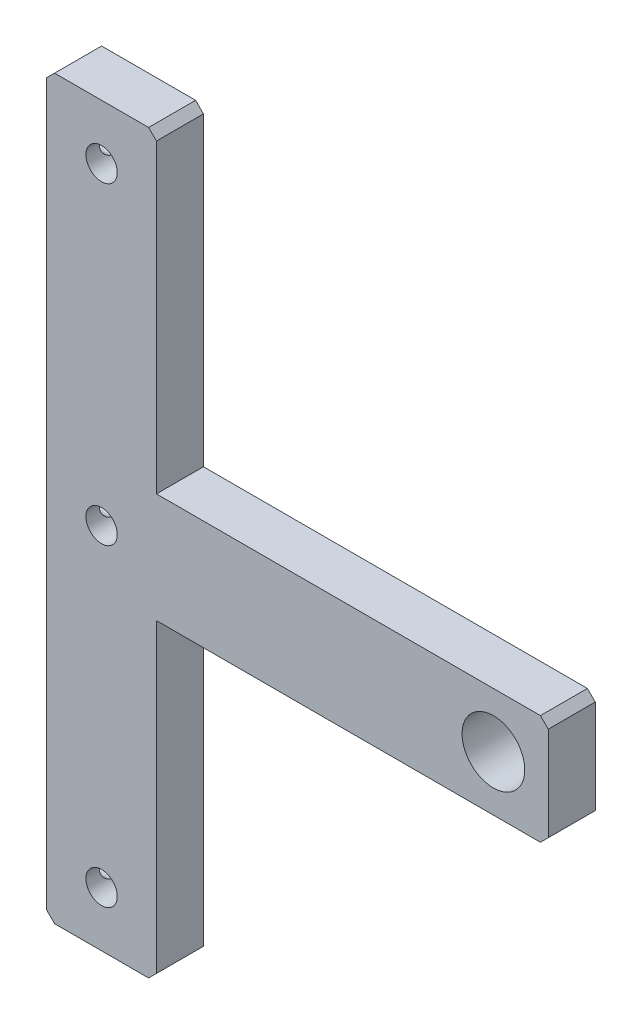
from build123d import *

# Parameters (mm, degrees)
EXTRUDE_1_DEPTH     = 6
SKETCH_4_R          = 2
SKETCH_4_R_2        = 4
CUT_EXTRUDE_2_DEPTH = 80.630396206
M3X0_5_1_REACH      = 81.63
M3X0_5_1_BORE_R     = 1.25
CHAMFER_1_SIZE      = 1


with BuildPart() as part:
    # ｽｹｯﾁ3 → ﾎﾞｽ - 押し出し1 (new body)
    with BuildSketch(Plane.XY):
        Polygon((0, -47), (0, 47), (14, 47), (14, 7), (64, 7), (64, -7), (14, -7), (14, -47), align=None)
    extrude(amount=EXTRUDE_1_DEPTH)

    # ｽｹｯﾁ4 → ｶｯﾄ - 押し出し2 (cut, through all)
    with BuildSketch(Plane.XY.offset(6)):
        with Locations((7, 40)):
            Circle(SKETCH_4_R)
        with Locations((7, -40)):
            Circle(SKETCH_4_R)
        with Locations((7, 0)):
            Circle(SKETCH_4_R)
        with Locations((57, 0)):
            Circle(SKETCH_4_R_2)
    extrude(amount=-CUT_EXTRUDE_2_DEPTH, mode=Mode.SUBTRACT)

    # M3x0.5 ねじ穴1 bore → M3x0.5 ねじ穴1 (cut, up to next)
    with BuildSketch(Plane.ZY, mode=Mode.PRIVATE) as m3x0_5_1_sk1:
        with Locations((3, -40)):
            Circle(M3X0_5_1_BORE_R)
    m3x0_5_1_tool1 = extrude(m3x0_5_1_sk1.sketch, amount=-M3X0_5_1_REACH, mode=Mode.PRIVATE) & part.part
    # M3x0.5 ねじ穴1 bore → M3x0.5 ねじ穴1 (cut, up to next)
    with BuildSketch(Plane.ZY, mode=Mode.PRIVATE) as m3x0_5_1_sk2:
        with Locations((3, 40)):
            Circle(M3X0_5_1_BORE_R)
    m3x0_5_1_tool2 = extrude(m3x0_5_1_sk2.sketch, amount=-M3X0_5_1_REACH, mode=Mode.PRIVATE) & part.part
    # M3x0.5 ねじ穴1 bore → M3x0.5 ねじ穴1 (cut, up to next)
    with BuildSketch(Plane.ZY, mode=Mode.PRIVATE) as m3x0_5_1_sk3:
        with Locations((3, 0)):
            Circle(M3X0_5_1_BORE_R)
    m3x0_5_1_tool3 = extrude(m3x0_5_1_sk3.sketch, amount=-M3X0_5_1_REACH, mode=Mode.PRIVATE) & part.part
    add(m3x0_5_1_tool1.solids().sort_by_distance((0, -40, 3))[0], mode=Mode.SUBTRACT)
    add(m3x0_5_1_tool2.solids().sort_by_distance((0, 40, 3))[0], mode=Mode.SUBTRACT)
    add(m3x0_5_1_tool3.solids().sort_by_distance((0, 0, 3))[0], mode=Mode.SUBTRACT)

    # 面取り1
    chamfer_1_edges = [part.edges().sort_by_distance(p)[0] for p in [
        (64, 7, 3),
        (64, -7, 3),
        (14, -47, 3),
        (0, -47, 3),
        (0, 47, 3),
        (14, 47, 3),
    ]]
    chamfer(chamfer_1_edges, length=CHAMFER_1_SIZE)


solid = part.part
